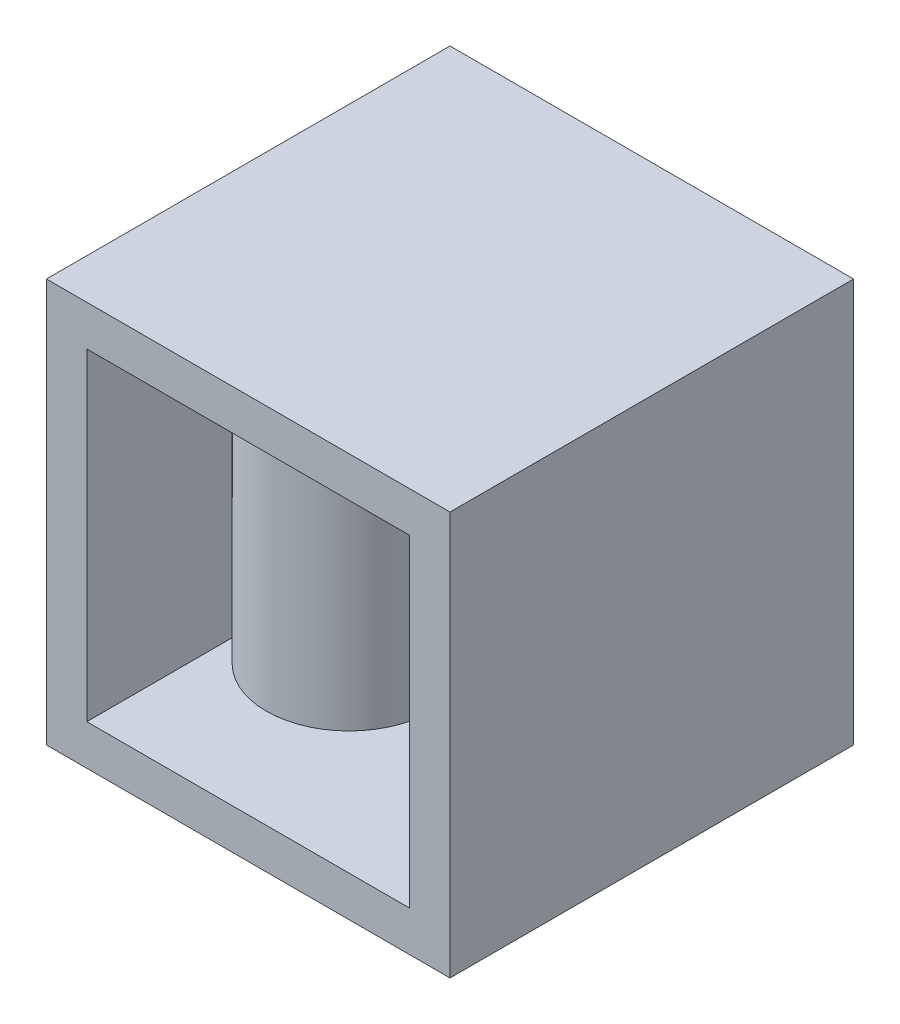
from build123d import *

# Parameters (mm, degrees)
SKETCH1_W           = 1000
SKETCH1_H           = 1000
SKETCH1_W_2         = 800
SKETCH1_H_2         = 800
BOSS_EXTRUDE1_DEPTH = 1000
SKETCH2_R           = 205
BOSS_EXTRUDE2_DEPTH = 600


with BuildPart() as part:
    # Sketch1 → Boss-Extrude1 (new body)
    with BuildSketch(Plane.XY):
        with Locations((500, 500)):
            Rectangle(SKETCH1_W, SKETCH1_H)
        with Locations((500, 500)):
            Rectangle(SKETCH1_W_2, SKETCH1_H_2, mode=Mode.SUBTRACT)
    extrude(amount=BOSS_EXTRUDE1_DEPTH)

    # Sketch2 → Boss-Extrude2 (add)
    with BuildSketch(Plane.XZ.offset(-900)):
        with Locations(Location((500, 750, 0), (0, 0, 90))):
            Circle(SKETCH2_R)
    extrude(amount=BOSS_EXTRUDE2_DEPTH)


solid = part.part
